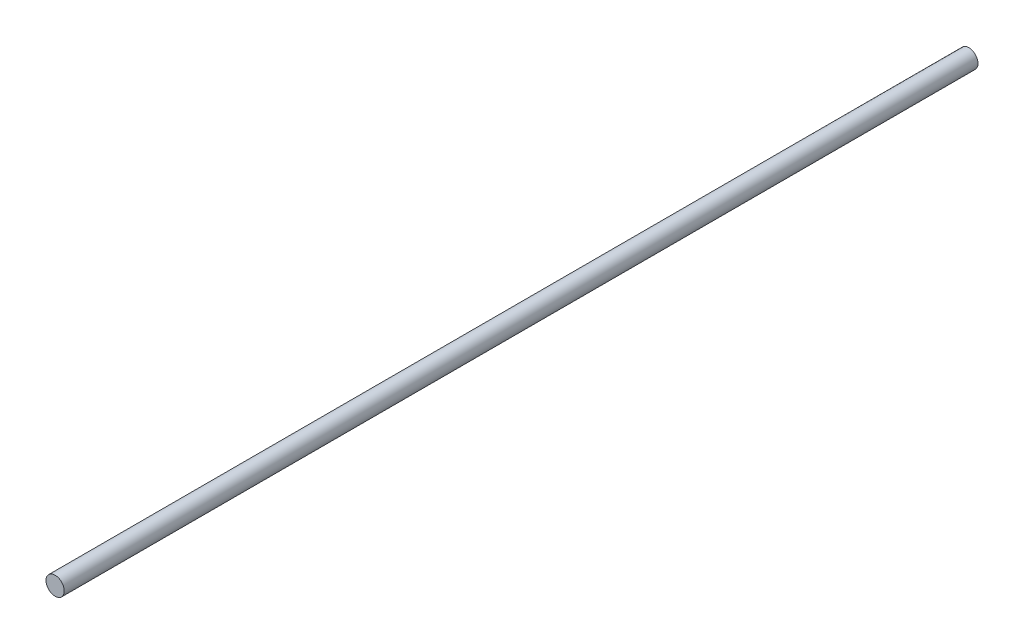
from build123d import *

# Parameters (mm, degrees)
SKETCH2_R           = 10
BOSS_EXTRUDE1_DEPTH = 1000


with BuildPart() as part:
    # Sketch2 → Boss-Extrude1 (new body)
    with BuildSketch(Plane.XY):
        Circle(SKETCH2_R)
    extrude(amount=BOSS_EXTRUDE1_DEPTH)


solid = part.part
